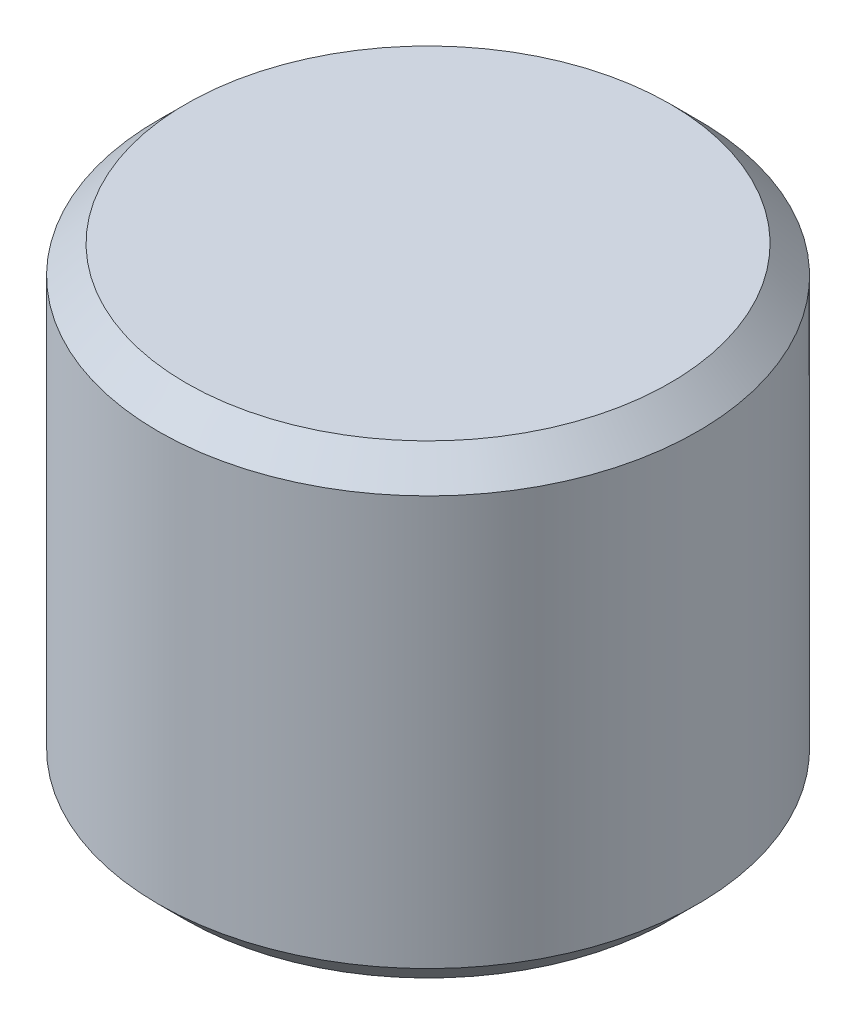
from build123d import *

# Parameters (mm, degrees)
SKETCH_1_R      = 14.5
EXTRUDE_1_DEPTH = 25
CHAMFER_1_SIZE  = 1.5


with BuildPart() as part:
    # 草图1 → 凸台-拉伸1 (new body)
    with BuildSketch(Plane(origin=(0, 0, 0), x_dir=(1, 0, 0), z_dir=(0, 1, 0))):
        with Locations(Location((0, 0, 0), (0, 0, 270))):
            Circle(SKETCH_1_R)
    extrude(amount=EXTRUDE_1_DEPTH)

    # 倒角1
    chamfer_1_edges = [part.edges().sort_by_distance(p)[0] for p in [
        (0, 0, -14.5),
        (0, 25, -14.5),
    ]]
    chamfer(chamfer_1_edges, length=CHAMFER_1_SIZE)


solid = part.part
